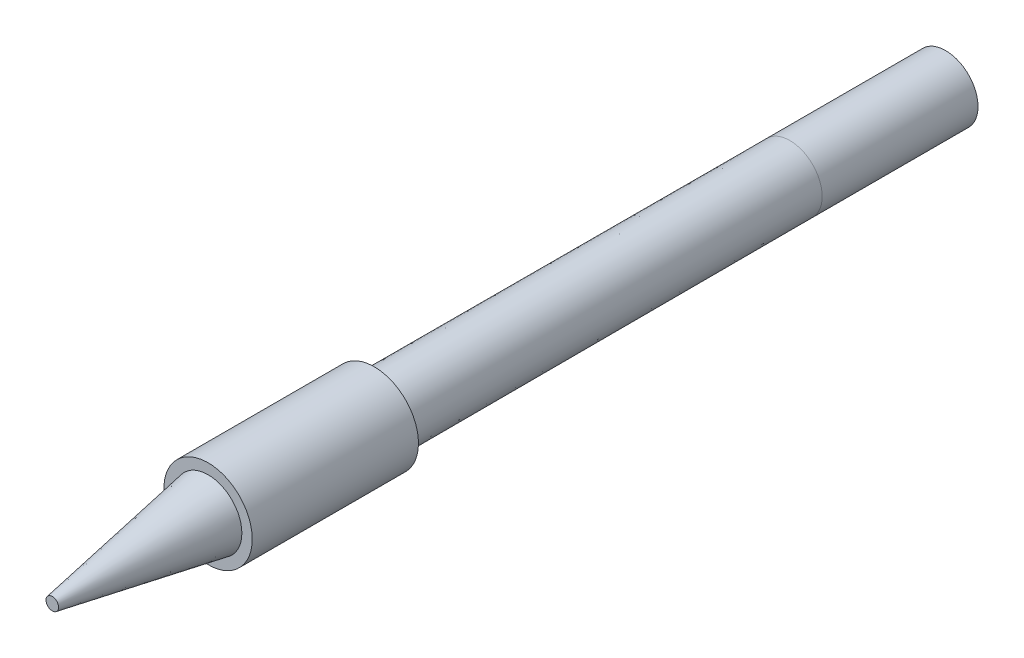
from build123d import *

# Parameters (mm, degrees)
SKETCH1_R           = 6.225
BOSS_EXTRUDE1_DEPTH = 80
BOSS_EXTRUDE1_DRAFT = -0.08
SKETCH1_2_R         = 6.225
BOSS_EXTRUDE2_DEPTH = 30
SKETCH2_R           = 8.5
BOSS_EXTRUDE3_DEPTH = 32
SKETCH3_R           = 6.5
BOSS_EXTRUDE4_DEPTH = 30
BOSS_EXTRUDE4_TAPER = 10


with BuildPart() as part:
    # Sketch1 → Boss-Extrude1 (with draft: the straight prism first)
    with BuildSketch(Plane.XY):
        Circle(SKETCH1_R)
    extrude(amount=BOSS_EXTRUDE1_DEPTH)
    # Boss-Extrude1: the draft: its side faces are tilted about the plane it starts from
    boss_extrude1_sides = [part.faces().sort_by_distance(p)[0] for p in [
        (-6.225, 0, 40),
    ]]
    draft(boss_extrude1_sides, Plane.XY, BOSS_EXTRUDE1_DRAFT)

    # Sketch1<2> → Boss-Extrude2 (add)
    with BuildSketch(Plane.XY):
        Circle(SKETCH1_2_R)
    extrude(amount=-BOSS_EXTRUDE2_DEPTH)

    # Sketch2 → Boss-Extrude3 (add)
    with BuildSketch(Plane.XY.offset(80)):
        Circle(SKETCH2_R)
    extrude(amount=BOSS_EXTRUDE3_DEPTH)

    # Sketch3 → Boss-Extrude4 (add)
    with BuildSketch(Plane.XY.offset(112)):
        Circle(SKETCH3_R)
    extrude(amount=BOSS_EXTRUDE4_DEPTH, taper=BOSS_EXTRUDE4_TAPER)


solid = part.part
